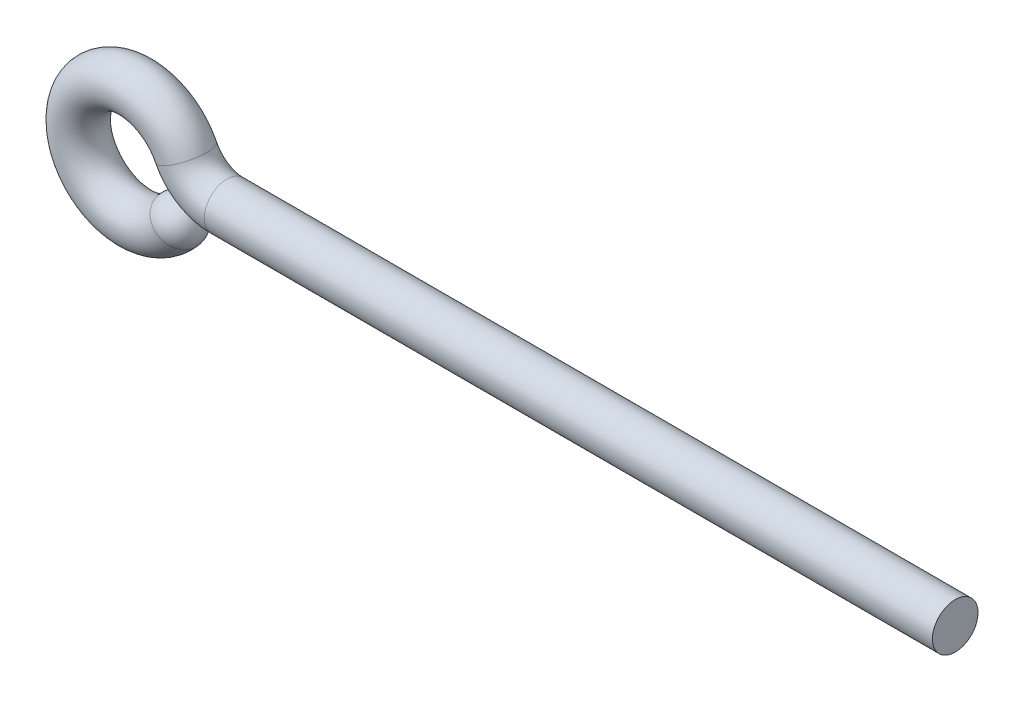
from build123d import *

# Parameters (mm, degrees)
SKETCH3_R           = 1
SKETCH5_R           = 1
BOSS_EXTRUDE1_DEPTH = 30
DOME1_FACE_RADIUS   = 1
DOME1_HEIGHT        = 1


with BuildPart() as part:
    # Sweep1: sweep along a path in Sketch1
    with BuildLine(Plane.XY) as sweep1_path:
        Line((0, 0), (-1.968871126, 0))
        ThreePointArc((-1.968871126, 0), (-3.022963679, 0.300326829), (-3.760483959, 1.111111111))
        ThreePointArc((-3.760483959, 1.111111111), (-8.482382241, 0.29627421), (-4.084888892, -1.606969024))
    # Sketch3 → Sweep1 (sweep)
    with BuildSketch(Plane(origin=(0, 0, 0), x_dir=(0, 0, -1), z_dir=(1, 0, 0))):
        Circle(SKETCH3_R)
    sweep(path=sweep1_path.line)

    # Sketch5 → Boss-Extrude1 (add)
    with BuildSketch(Plane(origin=(0, 0, 0), x_dir=(0, 0, -1), z_dir=(1, 0, 0))):
        with Locations(Location((0, 0, 0), (0, 0, 270))):
            Circle(SKETCH5_R)
    extrude(amount=BOSS_EXTRUDE1_DEPTH)

    # Dome1: a dome of height H over a round flat face of radius A is a cap of a sphere of radius (A * A + H * H) / (2 * H)
    dome1_r = (DOME1_FACE_RADIUS * DOME1_FACE_RADIUS + DOME1_HEIGHT * DOME1_HEIGHT) / (2 * DOME1_HEIGHT)
    dome1_base = Plane((-4.084888892, -1.606969024, 0), z_dir=(0.642787609687, 0.766044443119, 0))
    with Locations(dome1_base.offset(DOME1_HEIGHT - dome1_r)):
        dome1_ball = Sphere(dome1_r, mode=Mode.PRIVATE)
    add(split(dome1_ball, bisect_by=dome1_base, keep=Keep.TOP, mode=Mode.PRIVATE))


solid = part.part
